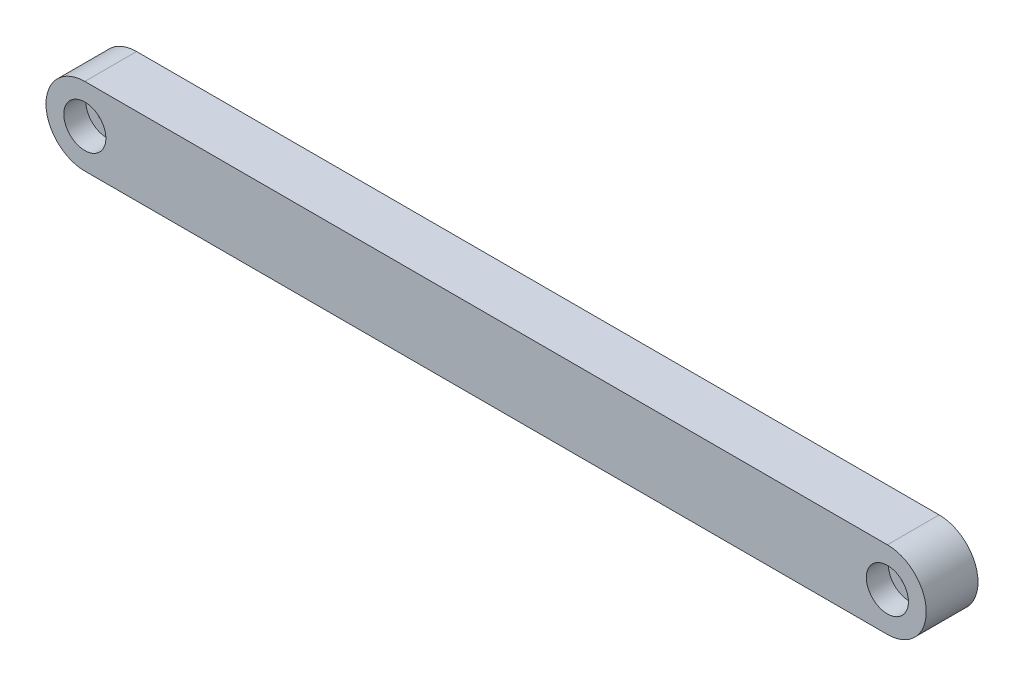
from build123d import *

# Parameters (mm, degrees)
BOSS_EXTRUDE1_DEPTH                                 = 8
CBORE_FOR_M3_HEX_SOCKET_HEAD_CAP_SCREW1_D           = 3.2
CBORE_FOR_M3_HEX_SOCKET_HEAD_CAP_SCREW1_CBORE_D     = 6.5
CBORE_FOR_M3_HEX_SOCKET_HEAD_CAP_SCREW1_CBORE_DEPTH = 3.4


with BuildPart() as part:
    # Sketch1 → Boss-Extrude1 (new body)
    with BuildSketch(Plane.XY):
        with BuildLine():
            Line((-62, 6), (62, 6))
            ThreePointArc((62, 6), (68, 0), (62, -6))
            Line((62, -6), (-62, -6))
            ThreePointArc((-62, -6), (-68, 0), (-62, 6))
        make_face()
    extrude(amount=BOSS_EXTRUDE1_DEPTH)

    # CBORE for M3 Hex Socket Head Cap Screw1 (through all)
    with Locations(Plane.XY.offset(8)):
        with Locations((-62, 0), (62, 0)):
            CounterBoreHole(CBORE_FOR_M3_HEX_SOCKET_HEAD_CAP_SCREW1_D / 2, CBORE_FOR_M3_HEX_SOCKET_HEAD_CAP_SCREW1_CBORE_D / 2, CBORE_FOR_M3_HEX_SOCKET_HEAD_CAP_SCREW1_CBORE_DEPTH)


solid = part.part
